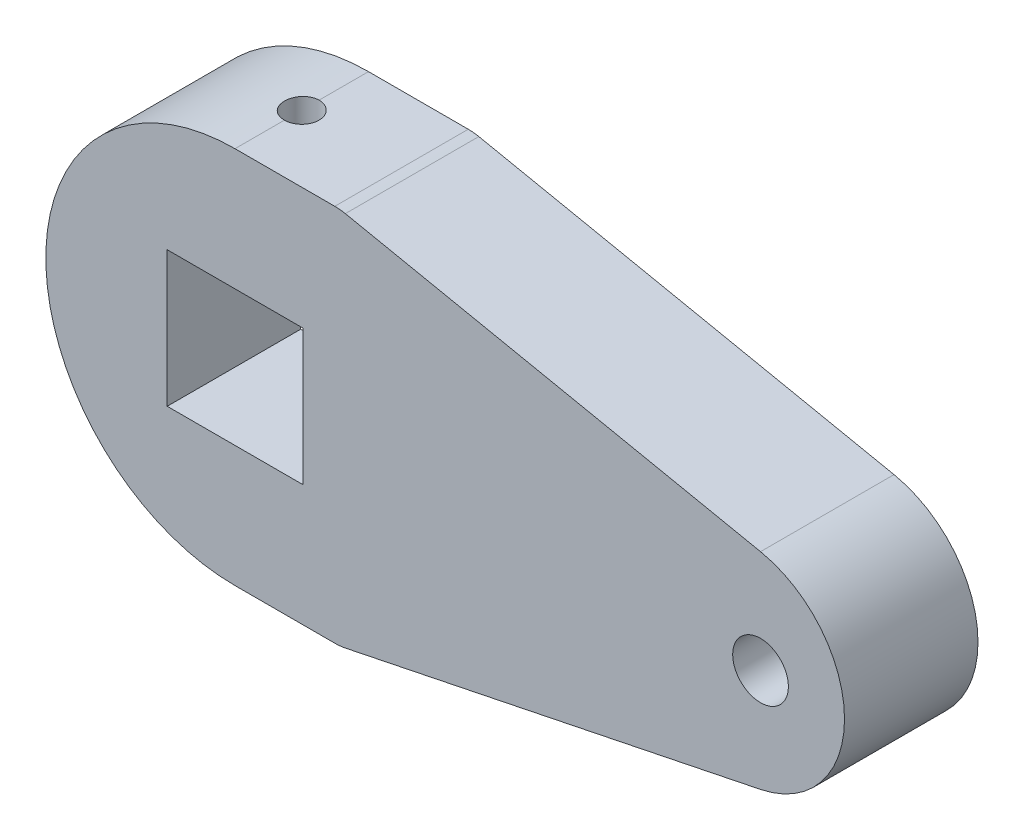
from build123d import *

# Parameters (mm, degrees)
SKETCH1_W                       = 12.9
SKETCH1_H                       = 12.9
BOSS_EXTRUDE1_DEPTH             = 12.7
TAP_DRILL_FOR_M4X0_7_TAP1_D     = 3.3
TAP_DRILL_FOR_M4X0_7_TAP1_DEPTH = 11.55
M5_CLEARANCE_HOLE1_D            = 5.3
FILLET1_R                       = 5


with BuildPart() as part:
    # Sketch1 → Boss-Extrude1 (new body)
    with BuildSketch(Plane.XY):
        with BuildLine():
            ThreePointArc((50, -9.796085513), (57.990843804, 0), (50, 9.796085513))
            Line((50, 9.796085513), (10, 18))
            Line((10, 18), (0, 18))
            ThreePointArc((0, 18), (-18, 0), (0, -18))
            Line((0, -18), (10, -18))
            Line((10, -18), (50, -9.796085513))
        make_face()
        Rectangle(SKETCH1_W, SKETCH1_H, mode=Mode.SUBTRACT)
    extrude(amount=BOSS_EXTRUDE1_DEPTH)

    # Tap Drill for M4x0.7 Tap1
    with Locations(Plane(origin=(0, 18, 6.35), x_dir=(0, 0, 1), z_dir=(0, 1, 0))):
        with Locations((0, 0)):
            Hole(TAP_DRILL_FOR_M4X0_7_TAP1_D / 2, depth=TAP_DRILL_FOR_M4X0_7_TAP1_DEPTH)

    # M5 Clearance Hole1 (through all)
    with Locations(Plane(origin=(50, 0, 0), x_dir=(-1, 0, 0), z_dir=(0, 0, -1))):
        with Locations((0, 0)):
            Hole(M5_CLEARANCE_HOLE1_D / 2)

    # Fillet1
    fillet1_edges = [part.edges().sort_by_distance(p)[0] for p in [
        (10, 18, 6.35),
        (10, -18, 6.35),
    ]]
    fillet(fillet1_edges, radius=FILLET1_R)


solid = part.part
